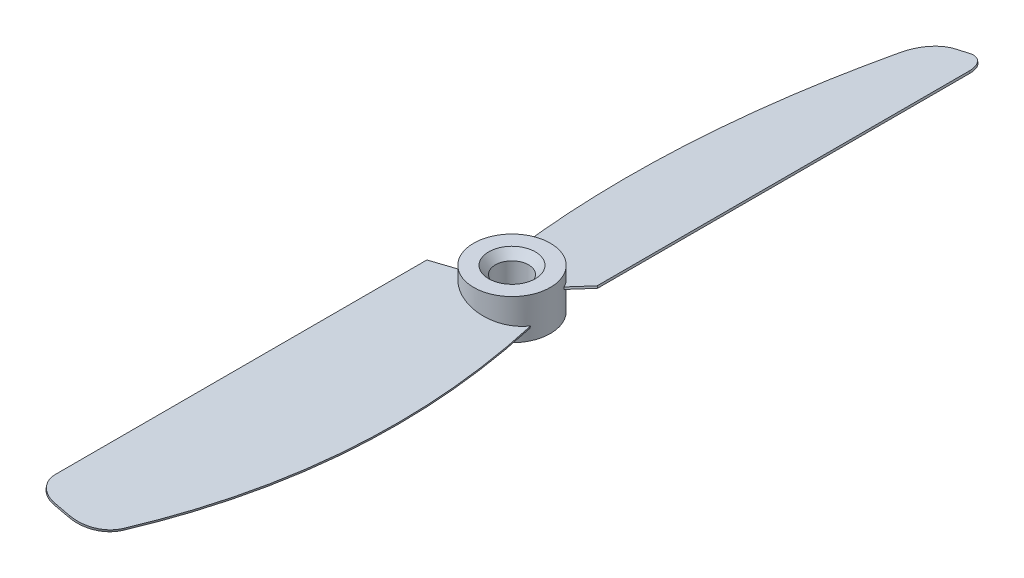
from build123d import *
from OCP.BRepFilletAPI import BRepFilletAPI_MakeChamfer

# Parameters (mm, degrees)
SKETCH1_R           = 5.75
BOSS_EXTRUDE1_DEPTH = 3
BOSS_EXTRUDE2_DEPTH = 0.15
CIRPATTERN1_COUNT   = 2
SKETCH4_R           = 2.5
CUT_EXTRUDE1_DEPTH  = 65.299031318
CHAMFER1_SIZE       = 1
CHAMFER1_SIZE2      = 1.191753593


with BuildPart() as part:
    # Sketch1 → Boss-Extrude1 (new, symmetric)
    with BuildSketch(Plane(origin=(0, 0, 0), x_dir=(1, 0, 0), z_dir=(0, 1, 0))):
        with Locations(Location((0, 0, 0), (0, 0, 270))):
            Circle(SKETCH1_R)
    extrude(amount=BOSS_EXTRUDE1_DEPTH, both=True)

    # Sketch3 → Boss-Extrude2 (add, symmetric)
    with BuildSketch(Plane(origin=(0, 0, 0), x_dir=(0.9743700647852351, -0.22495105434386548, 0), z_dir=(-0.2249510543438655, -0.9743700647852352, 0))):
        with BuildLine():
            Line((-4.454728917, 2.312449404), (-8.310390593, 4.705233436))
            Line((-8.310390593, 4.705233436), (-8.310390593, 60.5))
            ThreePointArc((-8.310390593, 60.5), (-7.431710937, 62.621320344), (-5.310390593, 63.5))
            Line((-5.310390593, 63.5), (-2.961672938, 63.5))
            ThreePointArc((-2.961672938, 63.5), (0.007877818, 62.522656871), (1.816520564, 59.972707322))
            add(Edge.make_bspline(
                [(1.816520564, 59.972707322), (11.305446488, 30.906067871), (5.007624384, 0.848133108)],
                knots=[0, 0, 0, 1, 1, 1], degree=2))
            add(Edge.make_bspline(
                [(-4.454728917, 2.312449404), (0.194469727, 8.941584866), (5.007624384, 0.848133108)],
                knots=[0, 0, 0, 1, 1, 1], degree=2))
        make_face()
    boss_extrude2 = extrude(amount=BOSS_EXTRUDE2_DEPTH, both=True)

    # CirPattern1: Boss-Extrude2 ×2 about axis
    cirpattern1_axis = Axis((0, -3, 0), (0, 1, 0))
    for i in range(1, CIRPATTERN1_COUNT):
        add(boss_extrude2.rotate(cirpattern1_axis, i * 360 / CIRPATTERN1_COUNT))

    # Sketch4 → Cut-Extrude1 (cut, through all)
    with BuildSketch(Plane(origin=(0, 3, 0), x_dir=(1, 0, 0), z_dir=(0, 1, 0))):
        with Locations(Location((0, 0, 0), (0, 0, 270))):
            Circle(SKETCH4_R)
    extrude(amount=-CUT_EXTRUDE1_DEPTH, mode=Mode.SUBTRACT)

    # Chamfer1: one chamfer whose edges measure the first distance from different faces: ONE call of the kernel's chamfer builder (chamfer() names one face for all edges)
    chamfer1_edges_1 = [part.edges().sort_by_distance(p)[0] for p in [
        (0, -3, -2.5),
    ]]
    chamfer1_side_1 = [part.faces().sort_by_distance(p)[0] for p in [
        (0, 0, -2.5),
    ]]
    chamfer1_edges_2 = [part.edges().sort_by_distance(p)[0] for p in [
        (0, 3, -2.5),
    ]]
    chamfer1_side_2 = [part.faces().sort_by_distance(p)[0] for p in [
        (0, 3, -5.58736544),
    ]]
    chamfer1 = BRepFilletAPI_MakeChamfer(part.part.solid().wrapped)
    for e in chamfer1_edges_1:
        chamfer1.Add(CHAMFER1_SIZE, CHAMFER1_SIZE2, e.wrapped, chamfer1_side_1[0].wrapped)  # the first distance lies on this face
    for e in chamfer1_edges_2:
        chamfer1.Add(CHAMFER1_SIZE, CHAMFER1_SIZE2, e.wrapped, chamfer1_side_2[0].wrapped)  # the first distance lies on this face
    add(Compound.cast(chamfer1.Shape()), mode=Mode.REPLACE)


solid = part.part
